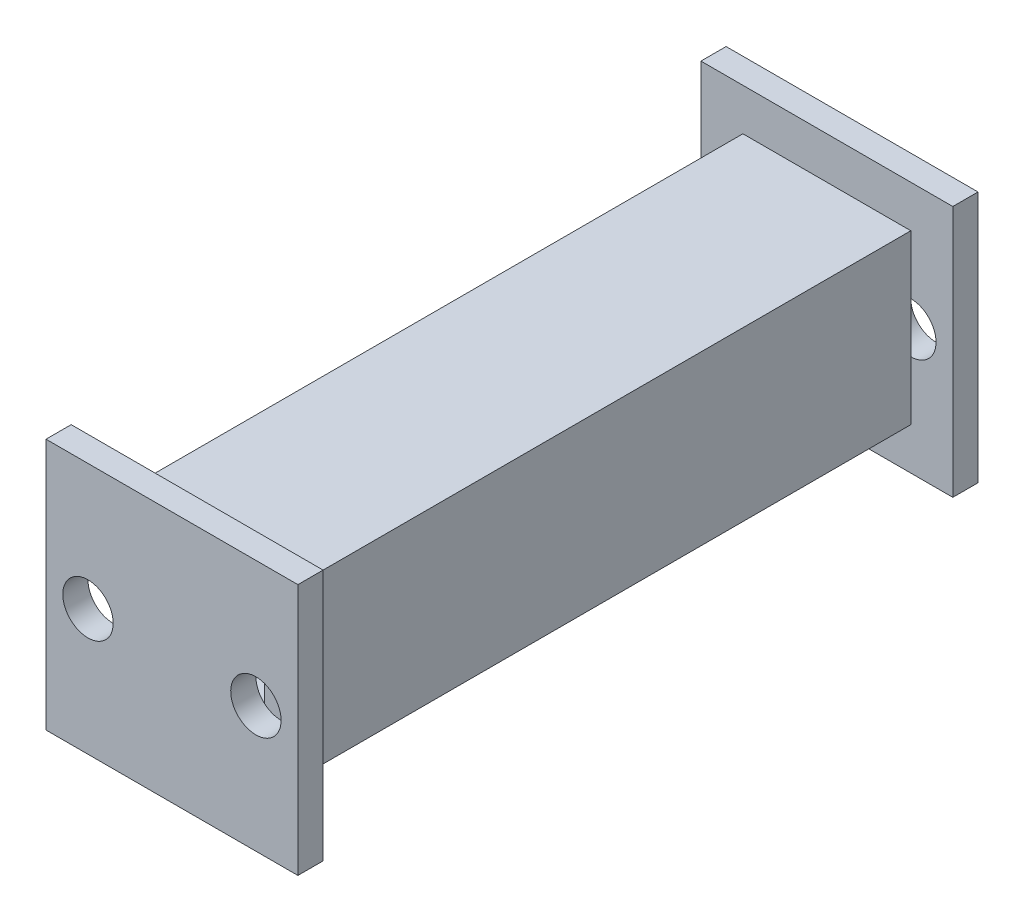
from build123d import *

# Parameters (mm, degrees)
SKETCH_8_W      = 80
SKETCH_8_H      = 80
SKETCH_8_W_2    = 64
SKETCH_8_H_2    = 64
EXTRUDE_1_DEPTH = 150
SKETCH_9_W      = 120
SKETCH_9_H      = 120
SKETCH_9_R      = 12
EXTRUDE_2_DEPTH = 12
EXTRUDE_START   = 12
SKETCH_10_W     = 120
SKETCH_10_H     = 120
SKETCH_10_R     = 12
EXTRUDE_3_DEPTH = 12


with BuildPart() as part:
    # 草图8 → 凸台-拉伸1 (new, symmetric)
    with BuildSketch(Plane.XY):
        Rectangle(SKETCH_8_W, SKETCH_8_H)
        Rectangle(SKETCH_8_W_2, SKETCH_8_H_2, mode=Mode.SUBTRACT)
    extrude(amount=EXTRUDE_1_DEPTH, both=True)

    # 草图9 → 凸台-拉伸2 (add)
    with BuildSketch(Plane.XY.offset(150)):
        Rectangle(SKETCH_9_W, SKETCH_9_H)
        with Locations(Location((40, 0, 0), (0, 0, 228.189685104))):
            Circle(SKETCH_9_R, mode=Mode.SUBTRACT)
        with Locations(Location((-40, 0, 0), (0, 0, 270))):
            Circle(SKETCH_9_R, mode=Mode.SUBTRACT)
    extrude(amount=EXTRUDE_2_DEPTH)

    # 草图10 → 凸台-拉伸3 (add)
    with BuildSketch(Plane(origin=(0, 0, -150), x_dir=(-1, 0, 0), z_dir=(0, 0, -1)).offset(EXTRUDE_START)):
        Rectangle(SKETCH_10_W, SKETCH_10_H)
        with Locations(Location((40, 0, 0), (0, 0, 270))):
            Circle(SKETCH_10_R, mode=Mode.SUBTRACT)
        with Locations(Location((-40, 0, 0), (0, 0, 311.810314896))):
            Circle(SKETCH_10_R, mode=Mode.SUBTRACT)
    extrude(amount=-EXTRUDE_3_DEPTH)


solid = part.part
